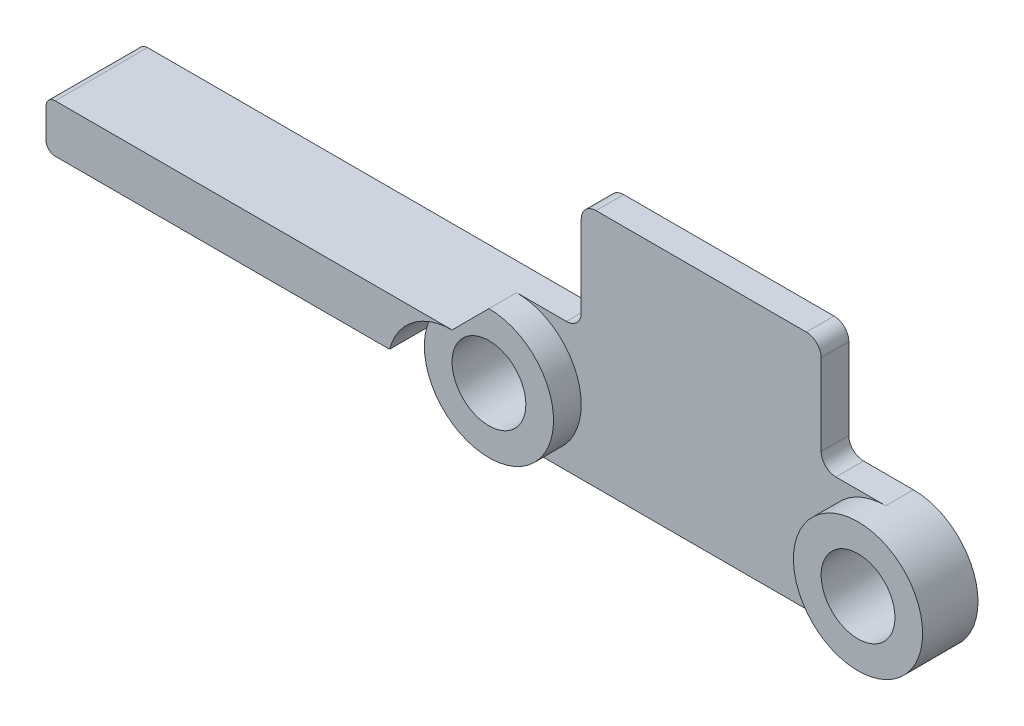
from build123d import *

# Parameters (mm, degrees)
SKETCH1_R           = 2
BOSS_EXTRUDE1_DEPTH = 1.5
BOSS_EXTRUDE2_DEPTH = 5
SKETCH2_R           = 3.5
SKETCH2_R_2         = 2
BOSS_EXTRUDE3_DEPTH = 1.5
FILLET2_R           = 0.8
FILLET3_R           = 0.5


with BuildPart() as part:
    # Sketch1 → Boss-Extrude1 (new body)
    with BuildSketch(Plane.XY):
        with BuildLine():
            Line((3.5, 3.5), (0, 3.5))
            ThreePointArc((0, 3.5), (-3.5, 0), (0, -3.5))
            Line((0, -3.5), (20, -3.5))
            ThreePointArc((20, -3.5), (23.5, 0), (20, 3.5))
            Line((20, 3.5), (16.5, 3.5))
            Line((16.5, 3.5), (16.5, 9.5))
            Line((16.5, 9.5), (3.5, 9.5))
            Line((3.5, 9.5), (3.5, 3.5))
        make_face()
        Circle(SKETCH1_R, mode=Mode.SUBTRACT)
        with Locations((20, 0)):
            Circle(SKETCH1_R, mode=Mode.SUBTRACT)
    extrude(amount=BOSS_EXTRUDE1_DEPTH)

    # Sketch1<3> → Boss-Extrude2 (add)
    with BuildSketch(Plane.XY):
        with BuildLine():
            ThreePointArc((-3.382776961, 0.898231613), (-2.133798181, 2.774329707), (0, 3.5))
            Line((0, 3.5), (-22, 3.5))
            Line((-22, 3.5), (-22, 0.898231613))
            Line((-22, 0.898231613), (-3.382776961, 0.898231613))
        make_face()
    extrude(amount=BOSS_EXTRUDE2_DEPTH)

    # Sketch2 → Boss-Extrude3 (add)
    # profile 1 of 2: a face of its own
    with BuildSketch(Plane.XY.offset(1.5)):
        with Locations((20, 0)):
            Circle(SKETCH2_R)
        with Locations((20, 0)):
            Circle(SKETCH2_R_2, mode=Mode.SUBTRACT)
    # profile 2 of 2: a face of its own
    with BuildSketch(Plane.XY.offset(1.5)):
        Circle(SKETCH2_R)
        Circle(SKETCH2_R_2, mode=Mode.SUBTRACT)
    extrude(amount=BOSS_EXTRUDE3_DEPTH)

    # Fillet2
    fillet2_edges = [part.edges().sort_by_distance(p)[0] for p in [
        (16.5, 9.5, 0.75),
        (16.5, 3.5, 0.75),
        (3.5, 9.5, 0.75),
        (3.5, 3.5, 0.75),
    ]]
    fillet(fillet2_edges, radius=FILLET2_R)

    # Fillet3
    fillet3_edges = [part.edges().sort_by_distance(p)[0] for p in [
        (-22, 3.5, 2.5),
        (-22, 0.898231613, 2.5),
    ]]
    fillet(fillet3_edges, radius=FILLET3_R)


solid = part.part
